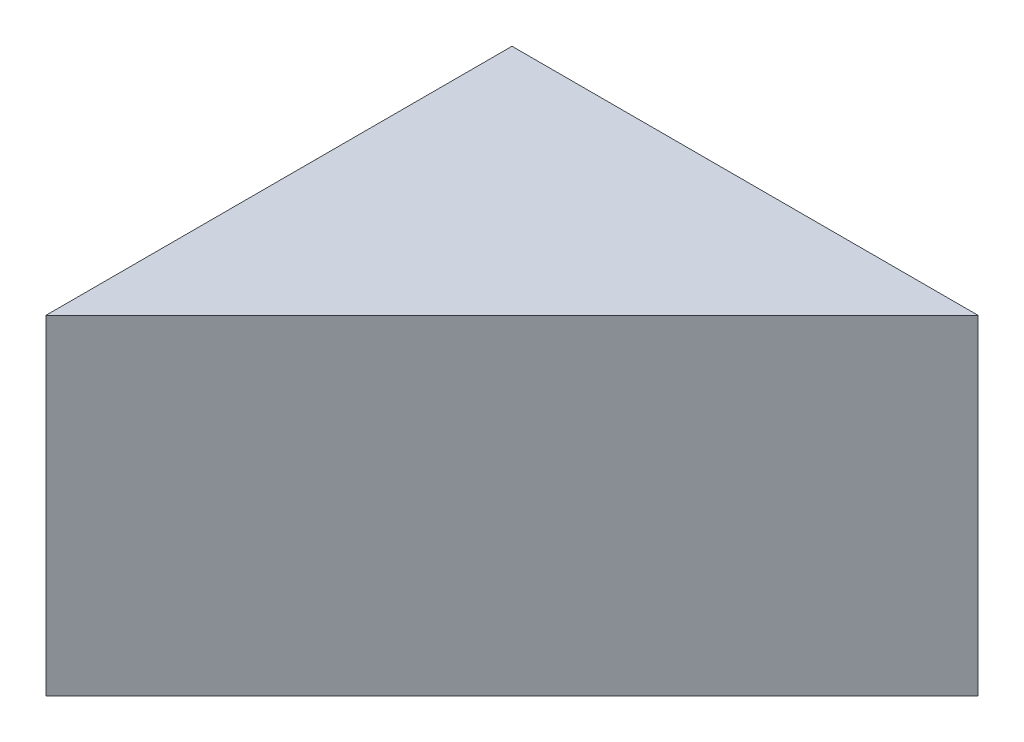
from build123d import *

# Parameters (mm, degrees)
BOSS_EXTRUDE1_DEPTH = 5


with BuildPart() as part:
    # Sketch1 → Boss-Extrude1 (new, symmetric)
    with BuildSketch(Plane(origin=(0, 0, 0), x_dir=(1, 0, 0), z_dir=(0, 1, 0))):
        Polygon((0, 0), (0, -14.142135624), (14.142135624, 0), align=None)
    extrude(amount=BOSS_EXTRUDE1_DEPTH, both=True)


solid = part.part
